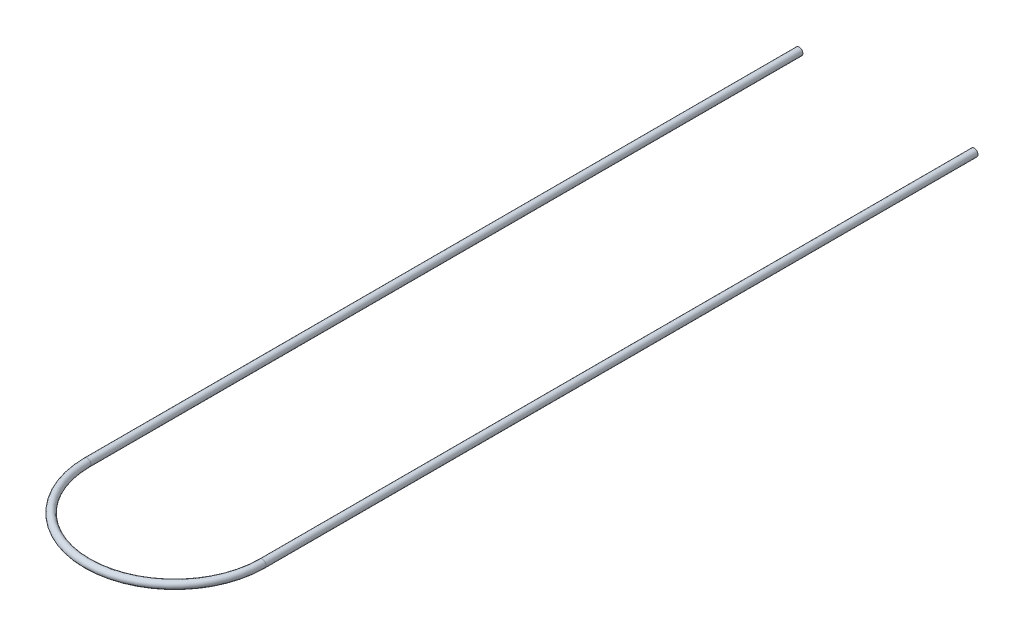
from build123d import *

# Parameters (mm, degrees)
SKETCH2_R   = 11.1
SKETCH2_R_2 = 9.95


with BuildPart() as part:
    # Sweep1: sweep along a path in Sketch1
    with BuildLine(Plane(origin=(0, 0, 0), x_dir=(1, 0, 0), z_dir=(0, 1, 0))) as sweep1_path:
        Line((486.47, -300), (486.47, -2440))
        ThreePointArc((486.47, -2440), (223.235, -2703.235), (-40, -2440))
        Line((-40, -2440), (-40, -300))
    # Sketch2 → Sweep1 (sweep)
    with BuildSketch(Plane(origin=(486.47, 0, 300), x_dir=(-1, 0, 0), z_dir=(0, 0, -1))):
        Circle(SKETCH2_R)
        Circle(SKETCH2_R_2, mode=Mode.SUBTRACT)
    sweep(path=sweep1_path.line)


solid = part.part
